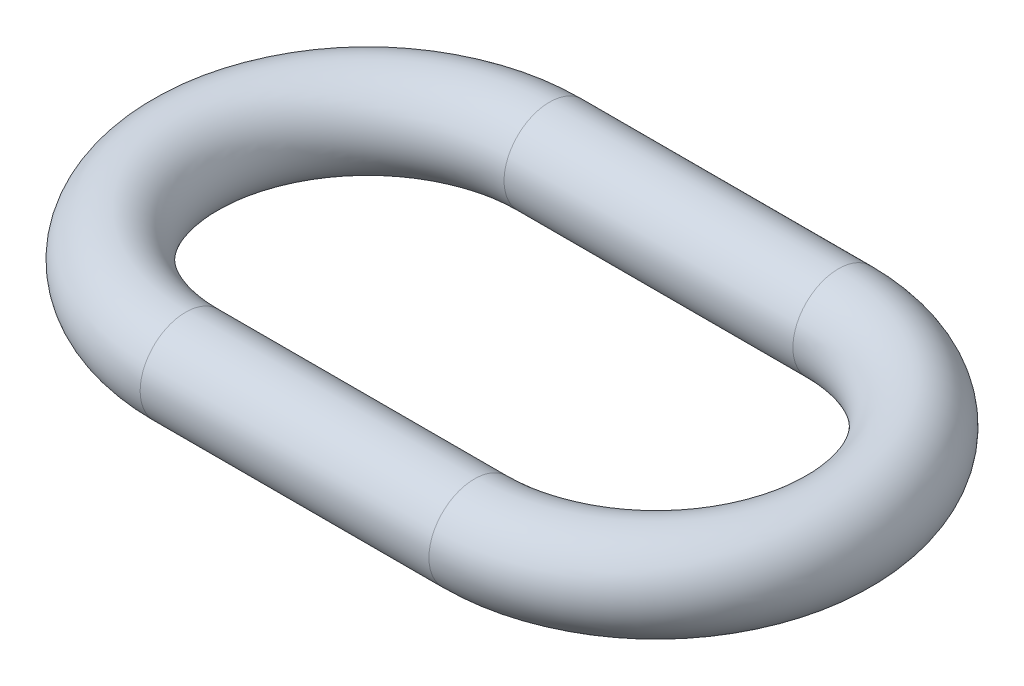
from build123d import *

# Parameters (mm, degrees)
SWEEP1_PROFILE_R = 1.27


with BuildPart() as part:
    # Sweep1: sweep along a path in Sketch1
    with BuildLine(Plane(origin=(0, 0, 0), x_dir=(1, 0, 0), z_dir=(0, 1, 0))) as sweep1_path:
        Line((-4.031209648, 5.08), (4.031209648, 5.08))
        ThreePointArc((4.031209648, 5.08), (9.111209648, 0), (4.031209648, -5.08))
        Line((4.031209648, -5.08), (-4.031209648, -5.08))
        ThreePointArc((-4.031209648, -5.08), (-9.111209648, 0), (-4.031209648, 5.08))
    # Sweep1 profile (on start of the path) → Sweep1 (sweep)
    with BuildSketch(Plane(origin=(-4.031209648, 0, -5.08), x_dir=(0, 0, 1), z_dir=(1, 0, 0))):
        Circle(SWEEP1_PROFILE_R)
    sweep(path=sweep1_path.line)


solid = part.part
